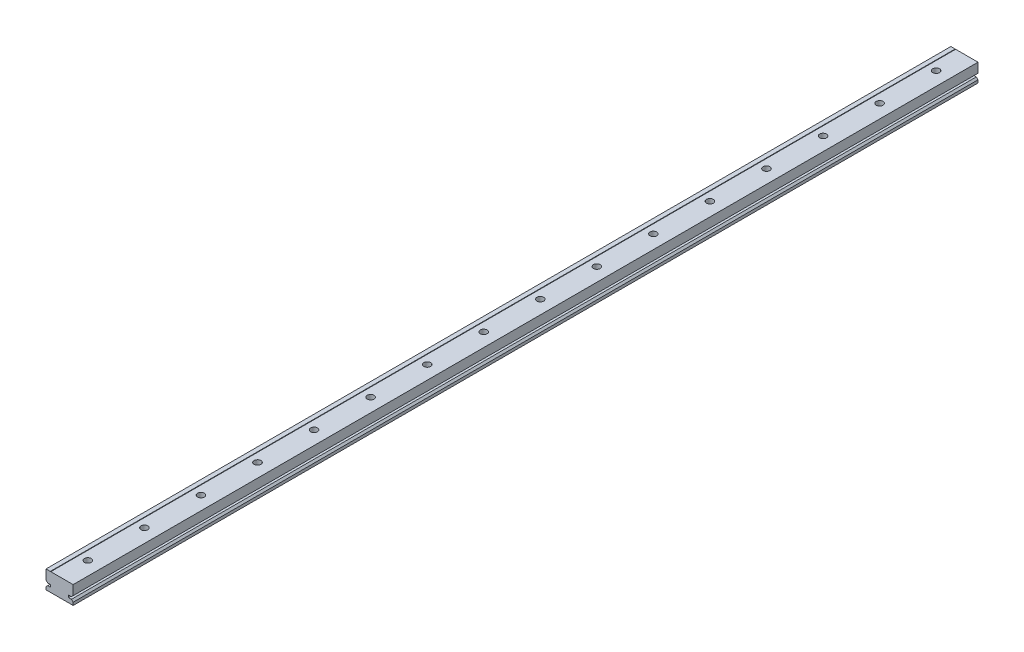
from build123d import *

# Parameters (mm, degrees)
BOSS_EXTRUDE1_DEPTH = 400
SKETCH2_R           = 1.5
CUT_EXTRUDE1_DEPTH  = 10
LPATTERN1_COUNT     = 16
LPATTERN1_PITCH     = 25


with BuildPart() as part:
    # Sketch1 → Boss-Extrude1 (new body)
    with BuildSketch(Plane.XY):
        Polygon((-6, -2.75), (-6, -4), (6, -4), (6, -2.75), (5.25, -2), (4, -2), (4, -1), (5.25, -1), (6, -0.25), (6, 4), (-3.888196601, 4), (-4, 3.9), (-4.111803399, 4), (-6, 4), (-6, -0.25), (-5.25, -1), (-4, -1), (-4, -2), (-5.25, -2), align=None)
    extrude(amount=BOSS_EXTRUDE1_DEPTH)

    # Sketch2 → Cut-Extrude1 (cut)
    with BuildSketch(Plane.XZ.offset(4)):
        with Locations(Location((0, 12.5, 0), (0, 0, 270))):
            Circle(SKETCH2_R)
    cut_extrude1 = extrude(amount=-CUT_EXTRUDE1_DEPTH, mode=Mode.SUBTRACT)

    # LPattern1: Cut-Extrude1 ×16
    with Locations(*[(0, 0, i * LPATTERN1_PITCH) for i in range(1, LPATTERN1_COUNT)]):
        add(cut_extrude1, mode=Mode.SUBTRACT)


solid = part.part
